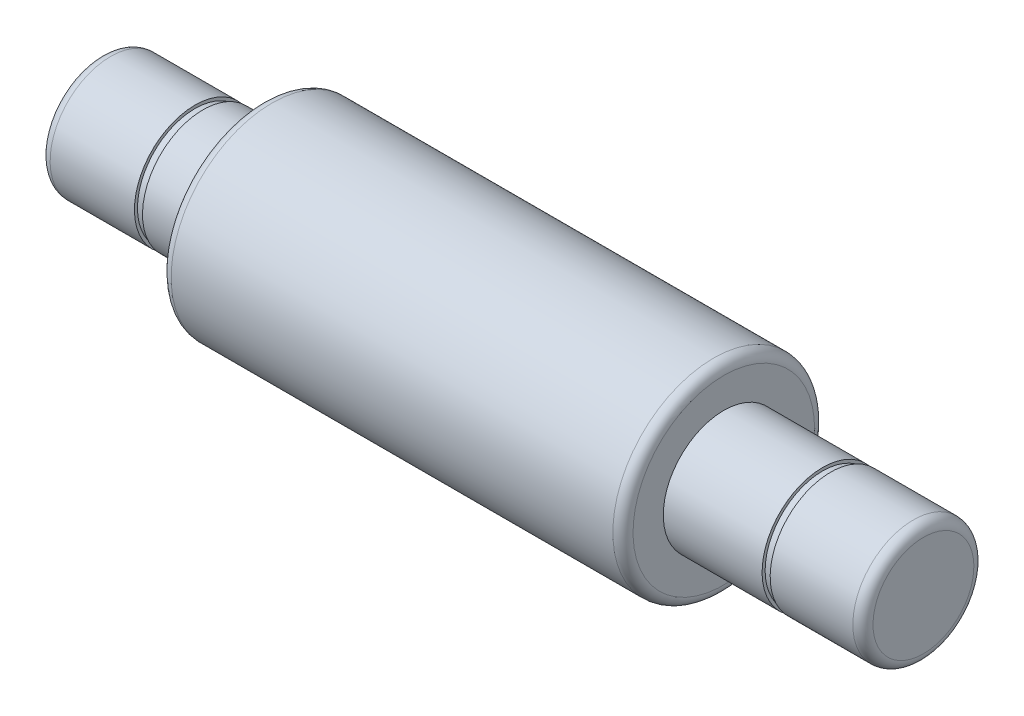
from build123d import *

# Parameters (mm, degrees)
SKETCH2_R           = 5
SKETCH2_R_2         = 3
CUT_EXTRUDE2_DEPTH  = 1.9
FILLET1_R           = 0.5
BOSS_EXTRUDE2_START = 0.1
SKETCH4_R           = 3
SKETCH4_R_2         = 2.85
BOSS_EXTRUDE2_DEPTH = 0.1
SKETCH6_R           = 3
SKETCH6_R_2         = 2.85
BOSS_EXTRUDE3_DEPTH = 0.02
BOSS_EXTRUDE4_START = 0.08
SKETCH7_R           = 3
SKETCH7_R_2         = 2.85
BOSS_EXTRUDE4_DEPTH = 0.08


with BuildPart() as part:
    # Sketch1 → Revolve1 (revolve)
    with BuildSketch(Plane.XY, mode=Mode.PRIVATE) as revolve1_sk:
        Polygon((-12.4, 5), (12.4, 5), (12.4, 3), (15.32, 3), (15.32, 2.85), (15.82, 2.85), (15.82, 3), (20.4, 3), (20.4, 0), (-20.4, 0), (-20.4, 3), (-15.82, 3), (-15.82, 2.85), (-15.32, 2.85), (-15.32, 3), (-12.4, 3), align=None)
    revolve(revolve1_sk.sketch.rotate(Axis((-20.4, 0, 0), (1, 0, 0)), 180), axis=Axis((-20.4, 0, 0), (1, 0, 0)))

    # Sketch2 → Cut-Extrude2 (cut)
    with BuildSketch(Plane(origin=(12.4, 0, 0), x_dir=(0, 0, -1), z_dir=(1, 0, 0))):
        with Locations(Location((0, 0, 0), (0, 0, 270))):
            Circle(SKETCH2_R)
        with Locations(Location((0, 0, 0), (0, 0, 270))):
            Circle(SKETCH2_R_2, mode=Mode.SUBTRACT)
    extrude(amount=-CUT_EXTRUDE2_DEPTH, mode=Mode.SUBTRACT)

    # Fillet1
    fillet1_edges = [part.edges().sort_by_distance(p)[0] for p in [
        (20.4, 3, 0),
        (-20.4, 3, 0),
        (-12.4, 5, 0),
        (10.5, 5, 0),
    ]]
    fillet(fillet1_edges, radius=FILLET1_R)

    # Sketch4 → Boss-Extrude2 (add)
    with BuildSketch(Plane(origin=(-15.82, 0, 0), x_dir=(0, 0, -1), z_dir=(1, 0, 0)).offset(BOSS_EXTRUDE2_START)):
        with Locations(Location((0, 0, 0), (0, 0, 270))):
            Circle(SKETCH4_R)
        with Locations(Location((0, 0, 0), (0, 0, 270))):
            Circle(SKETCH4_R_2, mode=Mode.SUBTRACT)
    extrude(amount=-BOSS_EXTRUDE2_DEPTH)

    # Sketch6 → Boss-Extrude3 (add)
    with BuildSketch(Plane.ZY.offset(-15.82)):
        with Locations(Location((0, 0, 0), (0, 0, 270))):
            Circle(SKETCH6_R)
        with Locations(Location((0, 0, 0), (0, 0, 270))):
            Circle(SKETCH6_R_2, mode=Mode.SUBTRACT)
    extrude(amount=BOSS_EXTRUDE3_DEPTH)

    # Sketch7 → Boss-Extrude4 (add)
    with BuildSketch(Plane(origin=(15.32, 0, 0), x_dir=(0, 0, -1), z_dir=(1, 0, 0)).offset(BOSS_EXTRUDE4_START)):
        with Locations(Location((0, 0, 0), (0, 0, 270))):
            Circle(SKETCH7_R)
        with Locations(Location((0, 0, 0), (0, 0, 270))):
            Circle(SKETCH7_R_2, mode=Mode.SUBTRACT)
    extrude(amount=-BOSS_EXTRUDE4_DEPTH)


solid = part.part
